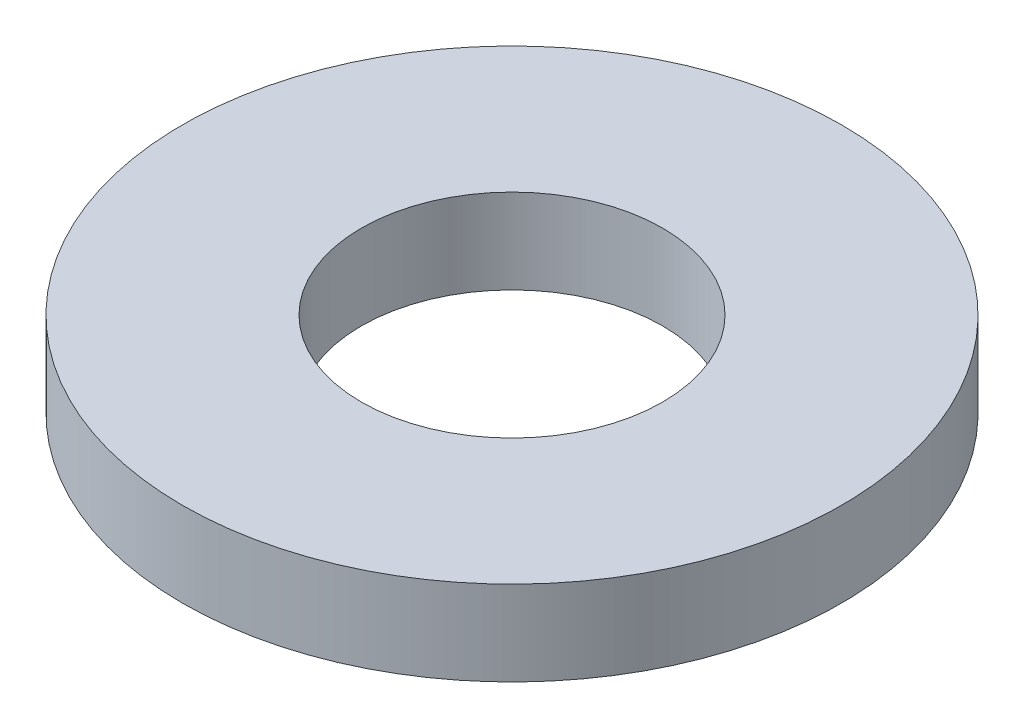
from build123d import *

# Parameters (mm, degrees)
SKETCH_1_R      = 3.5
SKETCH_1_R_2    = 1.6
EXTRUDE_1_DEPTH = 0.9


with BuildPart() as part:
    # Эскиз1 → Вытянуть1 (new body)
    with BuildSketch(Plane(origin=(0, 0, 0), x_dir=(1, 0, 0), z_dir=(0, 1, 0))):
        with Locations(Location((0, 0, 0), (0, 0, 270))):
            Circle(SKETCH_1_R)
        with Locations(Location((0, 0, 0), (0, 0, 270))):
            Circle(SKETCH_1_R_2, mode=Mode.SUBTRACT)
    extrude(amount=EXTRUDE_1_DEPTH)


solid = part.part
